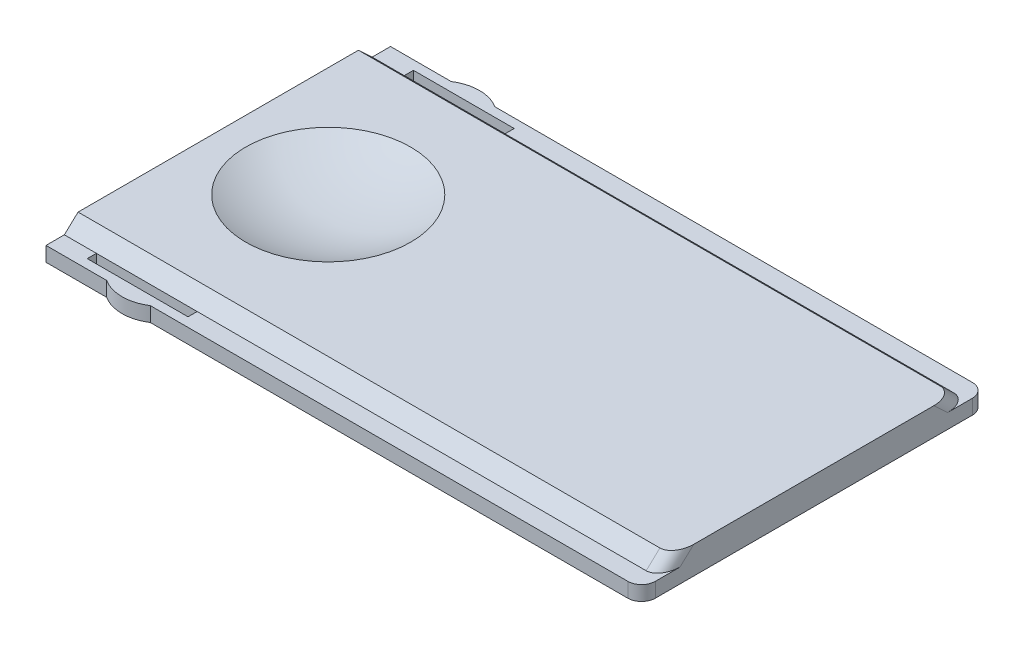
from build123d import *

# Parameters (mm, degrees)
BOSS_EXTRUDE1_DEPTH      = 65
SKETCH2_R                = 4.4
BOSS_EXTRUDE_LATCH_DEPTH = 1.6
SKETCH3_W                = 11
SKETCH3_H                = 1
CUT_EXTRUDE1_DEPTH       = 68.880851497
FILLET1_R                = 1.5


with BuildPart() as part:
    # Sketch1 → Boss-Extrude1 (new body)
    with BuildSketch(Plane(origin=(0, 0, 0), x_dir=(0, 0, -1), z_dir=(1, 0, 0))):
        Polygon((18.8, 0), (-18.8, 0), (-18.8, 1.6), (-16.8, 1.6), (-15.3, 3), (15.3, 3), (16.8, 1.6), (18.8, 1.6), align=None)
    extrude(amount=BOSS_EXTRUDE1_DEPTH)

    # Sketch2 → Boss-Extrude-Latch (add)
    with BuildSketch(Plane(origin=(0, 1.6, 0), x_dir=(1, 0, 0), z_dir=(0, 1, 0))):
        with Locations((9, 15.1)):
            Circle(SKETCH2_R)
        with Locations((9, -15.1)):
            Circle(SKETCH2_R)
    extrude(amount=-BOSS_EXTRUDE_LATCH_DEPTH)

    # Sketch3 → Cut-Extrude1 (cut, through all)
    with BuildSketch(Plane(origin=(0, 1.6, 0), x_dir=(1, 0, 0), z_dir=(0, 1, 0))):
        with Locations((9, 17.3)):
            Rectangle(SKETCH3_W, SKETCH3_H)
        with Locations((9, -17.3)):
            Rectangle(SKETCH3_W, SKETCH3_H)
    extrude(amount=-CUT_EXTRUDE1_DEPTH, mode=Mode.SUBTRACT)

    # Sketch4 → Cut-Revolve1 (revolve, cut)
    with BuildSketch(Plane.XY):
        with BuildLine():
            Line((12, 39.818181818), (12, 0.8))
            ThreePointArc((12, 0.8), (-7.509090909, 20.309090909), (12, 39.818181818))
        make_face()
    revolve(axis=Axis((12, 39.818181818, 0), (0, -1, 0)), mode=Mode.SUBTRACT)

    # Fillet1
    fillet1_edges = [part.edges().sort_by_distance(p)[0] for p in [
        (65, 0.8, -18.8),
        (65, 2.3, -16.05),
        (65, 2.3, 16.05),
        (65, 0.8, 18.8),
    ]]
    fillet(fillet1_edges, radius=FILLET1_R)


solid = part.part
